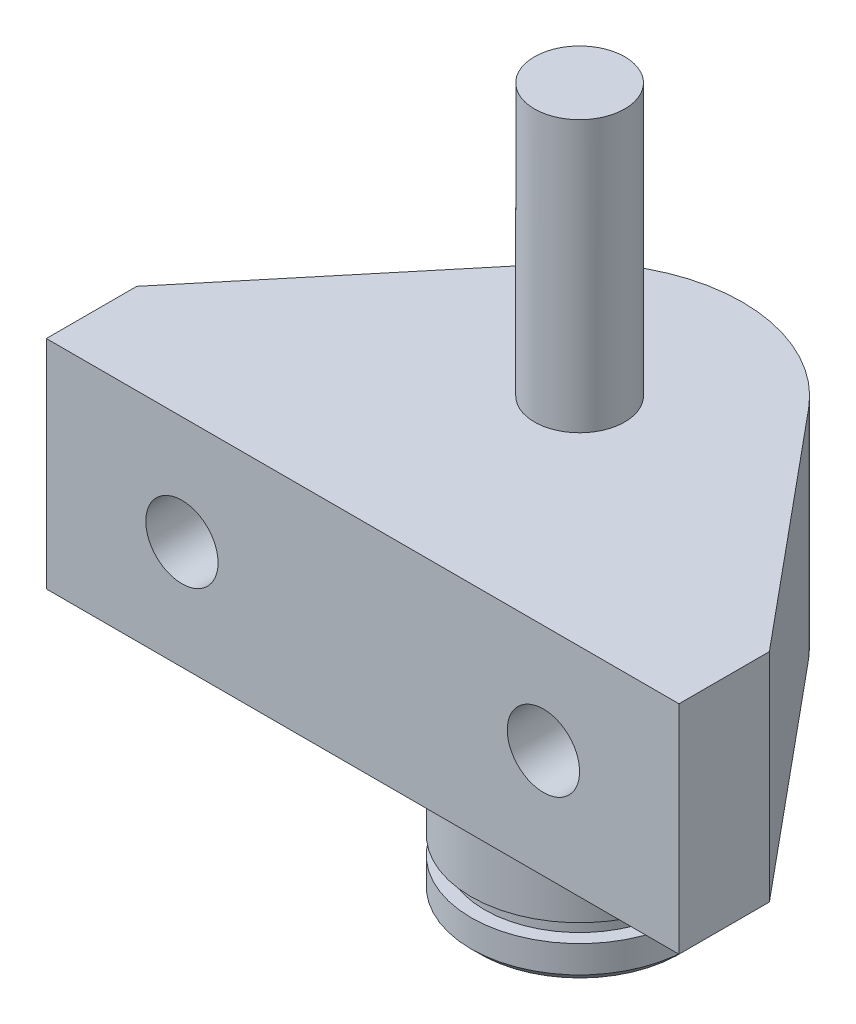
from build123d import *

# Parameters (mm, degrees)
EXTRUDE_1_DEPTH     = 12
SKETCH_2_R          = 6
EXTRUDE_2_DEPTH     = 9
SKETCH_3_R          = 5.25
EXTRUDE_3_DEPTH     = 1
SKETCH_4_R          = 6
EXTRUDE_4_DEPTH     = 2
CHAMFER_1_SIZE      = 0.5
SKETCH_5_R          = 2
CUT_EXTRUDE_1_DEPTH = 5
SKETCH_6_R          = 2.5
EXTRUDE_5_DEPTH     = 15


with BuildPart() as part:
    # 草图1 → 凸台-拉伸1 (new body)
    with BuildSketch(Plane(origin=(0, 0, 0), x_dir=(1, 0, 0), z_dir=(0, 1, 0))):
        with BuildLine():
            Line((-17.5, 6.09769995), (-6.926984364, 18.843732288))
            ThreePointArc((-6.926984364, 18.843732288), (0, 22.09769995), (6.926984364, 18.843732288))
            Line((6.926984364, 18.843732288), (17.5, 6.09769995))
            Line((17.5, 6.09769995), (17.5, 1.09769995))
            Line((17.5, 1.09769995), (-17.5, 1.09769995))
            Line((-17.5, 1.09769995), (-17.5, 6.09769995))
        make_face()
    extrude(amount=EXTRUDE_1_DEPTH)

    # 草图2 → 凸台-拉伸2 (add)
    with BuildSketch(Plane(origin=(0, 0, 0), x_dir=(1, 0, 0), z_dir=(0, 1, 0))):
        with Locations(Location((0, 13.09769995, 0), (0, 0, 270))):
            Circle(SKETCH_2_R)
    extrude(amount=-EXTRUDE_2_DEPTH)

    # 草图3 → 凸台-拉伸3 (add)
    with BuildSketch(Plane(origin=(0, -9, 0), x_dir=(-1, 0, 0), z_dir=(0, -1, 0))):
        with Locations(Location((0, 13.09769995, 0), (0, 0, 270))):
            Circle(SKETCH_3_R)
    extrude(amount=EXTRUDE_3_DEPTH)

    # 草图4 → 凸台-拉伸4 (add)
    with BuildSketch(Plane(origin=(0, -10, 0), x_dir=(-1, 0, 0), z_dir=(0, -1, 0))):
        with Locations(Location((0, 13.09769995, 0), (0, 0, 270))):
            Circle(SKETCH_4_R)
    extrude(amount=EXTRUDE_4_DEPTH)

    # 倒角1
    chamfer_1_edges = [part.edges().sort_by_distance(p)[0] for p in [
        (0, -12, -19.09769995),
    ]]
    chamfer(chamfer_1_edges, length=CHAMFER_1_SIZE)

    # 草图5 → 切除-拉伸1 (cut)
    with BuildSketch(Plane.XY.offset(-1.09769995)):
        with Locations((-10, 6)):
            Circle(SKETCH_5_R)
        with Locations(Location((10, 6, 0), (0, 0, 180))):
            Circle(SKETCH_5_R)
    extrude(amount=-CUT_EXTRUDE_1_DEPTH, mode=Mode.SUBTRACT)

    # 草图6 → 凸台-拉伸5 (add)
    with BuildSketch(Plane(origin=(0, 12, 0), x_dir=(1, 0, 0), z_dir=(0, 1, 0))):
        with Locations(Location((0, 13.09769995, 0), (0, 0, 90))):
            Circle(SKETCH_6_R)
    extrude(amount=EXTRUDE_5_DEPTH)


solid = part.part
